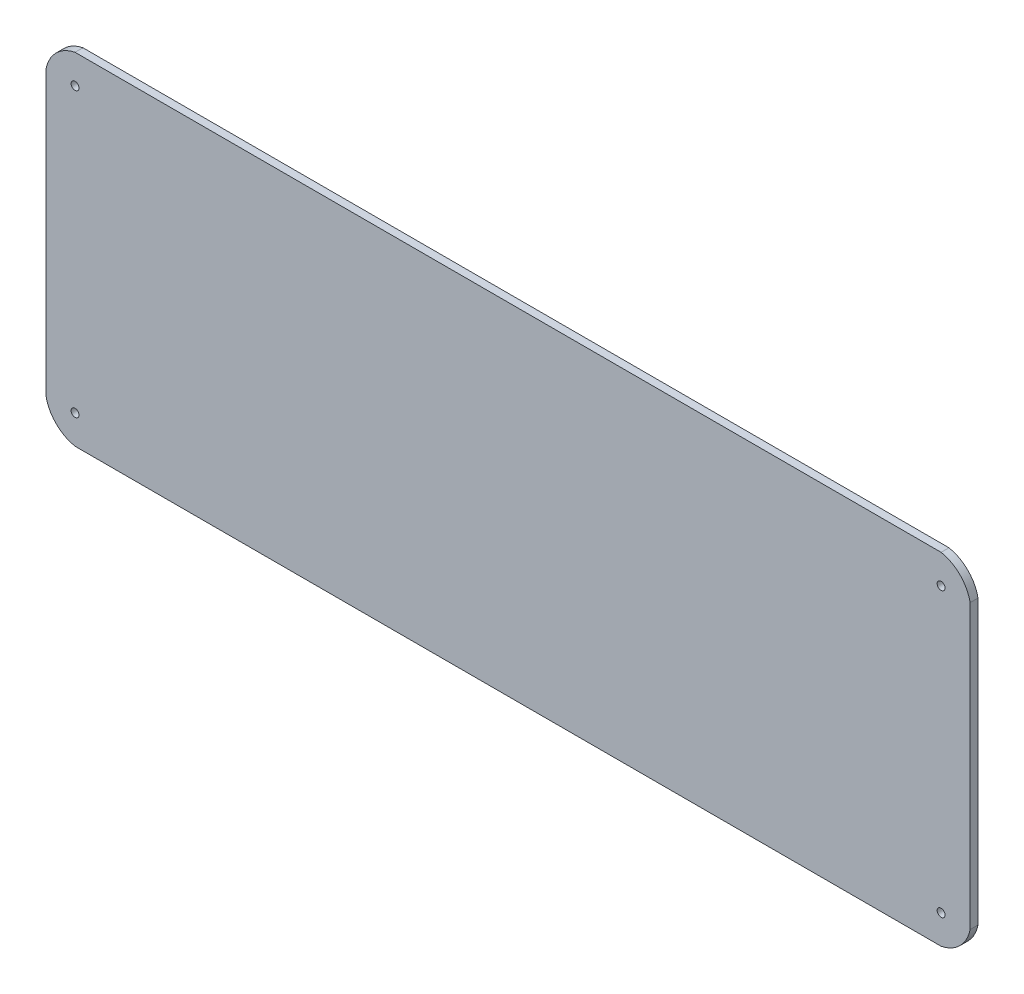
from build123d import *

# Parameters (mm, degrees)
MODEL_R                 = 1.5
SALIENTE_EXTRUIR1_DEPTH = 3


with BuildPart() as part:
    # Model → Saliente-Extruir1 (new body)
    with BuildSketch(Plane.XY):
        with BuildLine():
            Line((-175.629976592, 53.752538026), (-175.629976592, -54.126714803))
            ThreePointArc((-175.629976592, -54.126714803), (-171.788497074, -61.34560887), (-164.569603007, -65.187088388))
            Line((-164.569603007, -65.187088388), (165.430396993, -65.187088388))
            ThreePointArc((165.430396993, -65.187088388), (172.64929106, -61.34560887), (176.490770579, -54.126714803))
            Line((176.490770579, -54.126714803), (176.490770579, 53.752538026))
            ThreePointArc((176.490770579, 53.752538026), (172.64929106, 60.971432093), (165.430396993, 64.812911612))
            Line((165.430396993, 64.812911612), (-164.569603007, 64.812911612))
            ThreePointArc((-164.569603007, 64.812911612), (-171.788497074, 60.971432093), (-175.629976592, 53.752538026))
        make_face()
        with Locations((-164.569603007, 53.752538026)):
            Circle(MODEL_R, mode=Mode.SUBTRACT)
        with Locations((-164.569603007, -54.154241429)):
            Circle(MODEL_R, mode=Mode.SUBTRACT)
        with Locations((165.430396993, -54.126714803)):
            Circle(MODEL_R, mode=Mode.SUBTRACT)
        with Locations((165.430396993, 53.752538026)):
            Circle(MODEL_R, mode=Mode.SUBTRACT)
    extrude(amount=SALIENTE_EXTRUIR1_DEPTH)


solid = part.part
